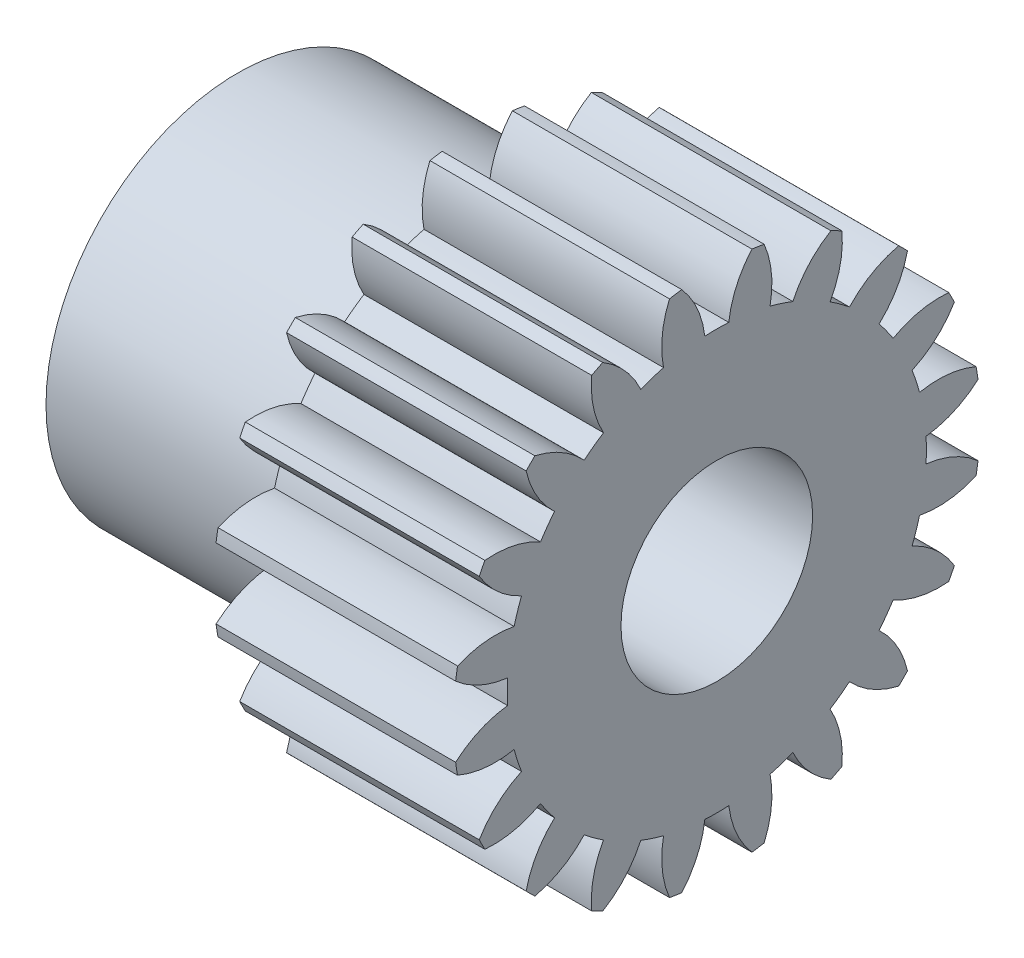
from build123d import *

# Parameters (mm, degrees)
BASPROSKE_W      = 5
BASPROSKE_H      = 5.5
TOOTHCUT_DEPTH   = 10.246621004
TEETHCUTS_COUNT  = 20
TEETHCUTS_ANGLE  = 342
HUBNEAONESKE_R   = 4
HUBNEARONE_DEPTH = 5
BORSKE_R         = 2
BORE_DEPTH       = 5.0000508


with BuildPart() as part:
    # BasProSke → Base-Revolve (revolve)
    with BuildSketch(Plane(origin=(0, 0, 0), x_dir=(1, 0, 0), z_dir=(0, 1, 0)), mode=Mode.PRIVATE) as base_revolve_sk:
        with Locations((2.5, 2.75)):
            Rectangle(BASPROSKE_W, BASPROSKE_H)
    revolve(base_revolve_sk.sketch.rotate(Axis((-10, 0, 0), (1, 0, 0)), 180), axis=Axis((-10, 0, 0), (1, 0, 0)))

    # TooCutSke → ToothCut (cut, through all)
    with BuildSketch(Plane(origin=(0, 0, 0), x_dir=(0, 0, -1), z_dir=(1, 0, 0))):
        with BuildLine():
            ThreePointArc((0.249903181, 4.366855207), (0, 4.374), (-0.249903181, 4.366855207))
            ThreePointArc((-0.249903181, 4.366855207), (-0.415207844, 4.95951031), (-0.752843848, 5.473871692))
            ThreePointArc((-0.752843848, 5.473871692), (0, 5.5254), (0.752843848, 5.473871692))
            ThreePointArc((0.752843848, 5.473871692), (0.415207844, 4.95951031), (0.249903181, 4.366855207))
        make_face()
    toothcut = extrude(amount=TOOTHCUT_DEPTH, mode=Mode.SUBTRACT)

    # TeethCuts: ToothCut ×20 about axis
    teethcuts_axis = Axis((-10, 0, 0), (1, 0, 0))
    for i in range(1, TEETHCUTS_COUNT):
        add(toothcut.rotate(teethcuts_axis, i * TEETHCUTS_ANGLE / (TEETHCUTS_COUNT - 1)), mode=Mode.SUBTRACT)

    # HubNeaOneSke → HubNearOne (add)
    with BuildSketch(Plane.ZY):
        with Locations(Location((0, 0, 0), (0, 0, 180))):
            Circle(HUBNEAONESKE_R)
    extrude(amount=HUBNEARONE_DEPTH)

    # BorSke → Bore (cut, symmetric)
    with BuildSketch(Plane(origin=(0, 0, 0), x_dir=(0, 0, -1), z_dir=(1, 0, 0))):
        with Locations(Location((0, 0, 0), (0, 0, 180))):
            Circle(BORSKE_R)
    extrude(amount=BORE_DEPTH, both=True, mode=Mode.SUBTRACT)


solid = part.part
